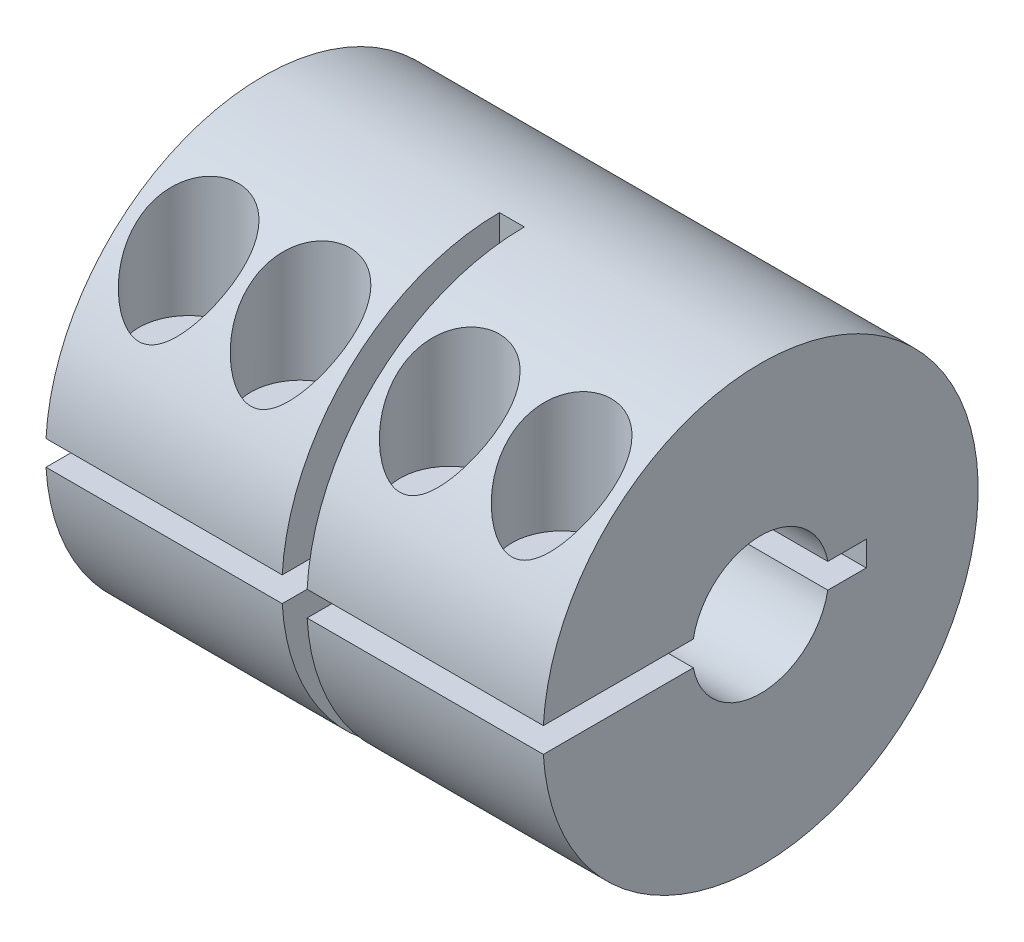
from build123d import *

# Parameters (mm, degrees)
SKIZZE2_W                       = 40
SKIZZE2_H                       = 17.5
SCHNITT_LINEAR_AUSTRAGEN1_DEPTH = 56.957573214
SKIZZE6_W                       = 2
SKIZZE6_H                       = 16.5
SCHNITT_LINEAR_AUSTRAGEN3_DEPTH = 56.957573214
SKIZZE10_R                      = 4
SCHNITT_LINEAR_AUSTRAGEN4_DEPTH = 11.5
KERNLOCH_F_R_M4_GEWINDE1_D      = 3.3


with BuildPart() as part:
    # Skizze2 → Rotation1 (revolve)
    with BuildSketch(Plane.XY, mode=Mode.PRIVATE) as rotation1_sk:
        with Locations((20, 8.75)):
            Rectangle(SKIZZE2_W, SKIZZE2_H)
    revolve(rotation1_sk.sketch.rotate(Axis((0, 17.5, 0), (1, 0, 0)), 270), axis=Axis((0, 17.5, 0), (1, 0, 0)))

    # Skizze3 → Schnitt-Linear austragen1 (cut, through all)
    with BuildSketch(Plane.ZY):
        with BuildLine():
            Line((5.408326913, 18.5), (19.826246022, 18.5))
            Line((19.826246022, 18.5), (19.826246022, 16.5))
            Line((19.826246022, 16.5), (5.408326913, 16.5))
            ThreePointArc((5.408326913, 16.5), (0, 12), (-5.408326913, 16.5))
            Line((-5.408326913, 16.5), (-8.5, 16.5))
            Line((-8.5, 16.5), (-8.5, 17.5))
            Line((-8.5, 17.5), (-8.5, 18.5))
            Line((-8.5, 18.5), (-5.408326913, 18.5))
            ThreePointArc((-5.408326913, 18.5), (0, 23), (5.408326913, 18.5))
        make_face()
    extrude(amount=-SCHNITT_LINEAR_AUSTRAGEN1_DEPTH, mode=Mode.SUBTRACT)

    # Skizze6 → Schnitt-Linear austragen3 (cut, through all)
    with BuildSketch(Plane.XY):
        with Locations((20, 8.25)):
            Rectangle(SKIZZE6_W, SKIZZE6_H)
        with Locations((20, 26.75)):
            Rectangle(SKIZZE6_W, SKIZZE6_H)
    extrude(amount=SCHNITT_LINEAR_AUSTRAGEN3_DEPTH, mode=Mode.SUBTRACT)

    # Skizze10 → Schnitt-Linear austragen4 (cut)
    with BuildSketch(Plane(origin=(0, 35, 0), x_dir=(1, 0, 0), z_dir=(0, 1, 0))):
        with Locations(Location((26, -11, 0), (0, 0, 270))):
            Circle(SKIZZE10_R)
        with Locations(Location((35, -11, 0), (0, 0, 270))):
            Circle(SKIZZE10_R)
        with Locations(Location((5, -11, 0), (0, 0, 270))):
            Circle(SKIZZE10_R)
        with Locations(Location((14, -11, 0), (0, 0, 270))):
            Circle(SKIZZE10_R)
    extrude(amount=-SCHNITT_LINEAR_AUSTRAGEN4_DEPTH, mode=Mode.SUBTRACT)

    # Kernloch für M4 Gewinde1 (through all)
    with Locations(Plane(origin=(5, 23.5, 11), x_dir=(0, 0, 1), z_dir=(0, 1, 0))):
        with Locations((0, 0), (0, 9), (0, 21), (0, 30)):
            Hole(KERNLOCH_F_R_M4_GEWINDE1_D / 2)


solid = part.part
